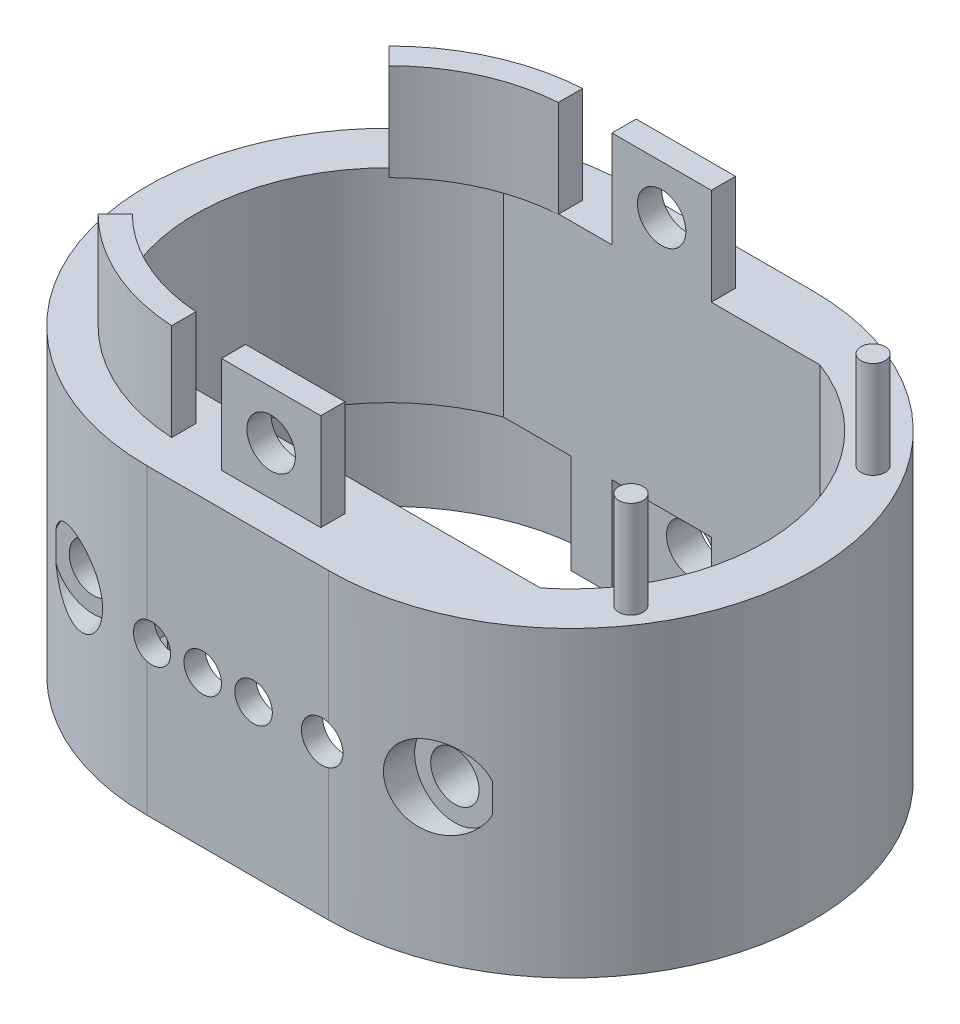
from build123d import *

# Parameters (mm, degrees)
BOSS_EXTRUDE1_DEPTH      = 12.5
BOSS_EXTRUDE1_DEPTH_BACK = 12.5
SKETCH3_R                = 1.55
SKETCH3_R_2              = 1.7
CUT_EXTRUDE1_DEPTH       = 7.5
SKETCH4_W                = 22.85
SKETCH4_H                = 17.75
CUT_EXTRUDE2_DEPTH       = 5.75
SKETCH5_R                = 2
CUT_EXTRUDE3_DEPTH       = 5.75
SKETCH6_R                = 3.325
CUT_EXTRUDE4_DEPTH       = 3
SKETCH7_R                = 4.825
CUT_EXTRUDE5_DEPTH       = 3
SKETCH9_R                = 1.1
SKETCH9_W                = 8.2
SKETCH9_H                = 2.4
CUT_EXTRUDE6_DEPTH       = 8.2
SKETCH10_R               = 2
CUT_EXTRUDE7_DEPTH       = 8.2
SKETCH11_R               = 1
SKETCH11_W               = 8.2
SKETCH11_H               = 2
BOSS_EXTRUDE2_DEPTH      = 8
CUT_EXTRUDE8_DEPTH       = 23
CUT_EXTRUDE8_DEPTH_BACK  = 24
SKETCH13_R               = 2


with BuildPart() as part:
    # Sketch1 → Boss-Extrude1 (new, two sides: drawn at the far end of the back side and taken through both)
    with BuildSketch(Plane(origin=(0, 0, 0), x_dir=(1, 0, 0), z_dir=(0, 1, 0)).offset(-BOSS_EXTRUDE1_DEPTH_BACK)):
        with BuildLine():
            Line((7.5, -20), (-7.5, -20))
            ThreePointArc((-7.5, -20), (-27.5, 0), (-7.5, 20))
            Line((-7.5, 20), (7.5, 20))
            ThreePointArc((7.5, 20), (27.5, 0), (7.5, -20))
        make_face()
        with BuildLine():
            Line((-13.067764363, 15), (13.067764363, 15))
            ThreePointArc((13.067764363, 15), (23.297278294, 2.538897101), (17.487492178, -12.5))
            Line((17.487492178, -12.5), (-17.487492178, -12.5))
            ThreePointArc((-17.487492178, -12.5), (-23.297278294, 2.538897101), (-13.067764363, 15))
        make_face(mode=Mode.SUBTRACT)
    extrude(amount=BOSS_EXTRUDE1_DEPTH + BOSS_EXTRUDE1_DEPTH_BACK)

    # Sketch3 → Cut-Extrude1 (cut)
    with BuildSketch(Plane.XY.offset(20)):
        with Locations((-7.1, 0)):
            Circle(SKETCH3_R)
        with Locations((-2.9, 0)):
            Circle(SKETCH3_R)
        with Locations((1.3, 0)):
            Circle(SKETCH3_R)
        with Locations((6.95, 0)):
            Circle(SKETCH3_R_2)
    extrude(amount=-CUT_EXTRUDE1_DEPTH, mode=Mode.SUBTRACT)

    # Sketch4 → Cut-Extrude2 (cut)
    with BuildSketch(Plane(origin=(0, 0, 12.5), x_dir=(-1, 0, 0), z_dir=(0, 0, -1))):
        Rectangle(SKETCH4_W, SKETCH4_H)
    extrude(amount=-CUT_EXTRUDE2_DEPTH, mode=Mode.SUBTRACT)

    # Sketch5 → Cut-Extrude3 (cut)
    with BuildSketch(Plane(origin=(0, 0, 12.5), x_dir=(-1, 0, 0), z_dir=(0, 0, -1))):
        with Locations((14.925, 0)):
            Circle(SKETCH5_R)
        with Locations((-14.925, 0)):
            Circle(SKETCH5_R)
    extrude(amount=-CUT_EXTRUDE3_DEPTH, mode=Mode.SUBTRACT)

    # Sketch6 → Cut-Extrude4 (cut)
    with BuildSketch(Plane.XY.offset(20)):
        with Locations((-14.925, 0)):
            Circle(SKETCH6_R)
        with Locations((14.925, 0)):
            Circle(SKETCH6_R)
    extrude(amount=-CUT_EXTRUDE4_DEPTH, mode=Mode.SUBTRACT)

    # Sketch7 → Cut-Extrude5 (cut)
    with BuildSketch(Plane(origin=(0, 0, 12.5), x_dir=(-1, 0, 0), z_dir=(0, 0, -1))):
        with Locations((14.925, 0)):
            Circle(SKETCH7_R)
        with Locations((-14.925, 0)):
            Circle(SKETCH7_R)
    extrude(amount=CUT_EXTRUDE5_DEPTH, mode=Mode.SUBTRACT)

    # Sketch9 → Cut-Extrude6 (cut)
    with BuildSketch(Plane.XZ.offset(12.5)):
        with Locations((22.466629547, 10)):
            Circle(SKETCH9_R)
        with Locations((22.466629547, -10)):
            Circle(SKETCH9_R)
        with Locations((0, -16.2)):
            Rectangle(SKETCH9_W, SKETCH9_H)
        with BuildLine():
            Line((-7.5, 14.9), (-7.5, 17.1))
            ThreePointArc((-7.5, 17.1), (-24.6, 0), (-7.5, -17.1))
            Line((-7.5, -17.1), (-7.5, -14.9))
            ThreePointArc((-7.5, -14.9), (-22.4, 0), (-7.5, 14.9))
        make_face()
    extrude(amount=-CUT_EXTRUDE6_DEPTH, mode=Mode.SUBTRACT)

    # Sketch10 → Cut-Extrude7 (cut)
    with BuildSketch(Plane.XY.offset(-17.4)):
        with Locations((0, -8.4)):
            Circle(SKETCH10_R)
    extrude(amount=-CUT_EXTRUDE7_DEPTH, mode=Mode.SUBTRACT)

    # Sketch11 → Boss-Extrude2 (add)
    with BuildSketch(Plane(origin=(0, 12.5, 0), x_dir=(1, 0, 0), z_dir=(0, 1, 0))):
        with Locations((22.466629547, -10)):
            Circle(SKETCH11_R)
        with Locations((22.466629547, 10)):
            Circle(SKETCH11_R)
        with BuildLine():
            Line((-8.5, -14.966629547), (-8.5, -16.970562748))
            ThreePointArc((-8.5, -16.970562748), (-14.464941324, -15.50772686), (-19.52081528, -12.02081528))
            Line((-19.52081528, -12.02081528), (-18.106601718, -10.606601718))
            ThreePointArc((-18.106601718, -10.606601718), (-13.699254917, -13.659035049), (-8.5, -14.966629547))
        make_face()
        with BuildLine():
            Line((-18.106601718, 10.606601718), (-19.52081528, 12.02081528))
            ThreePointArc((-19.52081528, 12.02081528), (-14.464941324, 15.50772686), (-8.5, 16.970562748))
            Line((-8.5, 16.970562748), (-8.5, 14.966629547))
            ThreePointArc((-8.5, 14.966629547), (-13.699254917, 13.659035049), (-18.106601718, 10.606601718))
        make_face()
        with Locations((0, 16)):
            Rectangle(SKETCH11_W, SKETCH11_H)
        with Locations((0, -16.25)):
            Rectangle(SKETCH11_W, SKETCH11_H)
    extrude(amount=BOSS_EXTRUDE2_DEPTH)

    # Sketch13 → Cut-Extrude8 (cut, two sides: drawn at the far end of the back side and taken through both)
    with BuildSketch(Plane.XY.offset(-CUT_EXTRUDE8_DEPTH_BACK)):
        with Locations((0, 16.5)):
            Circle(SKETCH13_R)
    extrude(amount=CUT_EXTRUDE8_DEPTH + CUT_EXTRUDE8_DEPTH_BACK, mode=Mode.SUBTRACT)


solid = part.part
